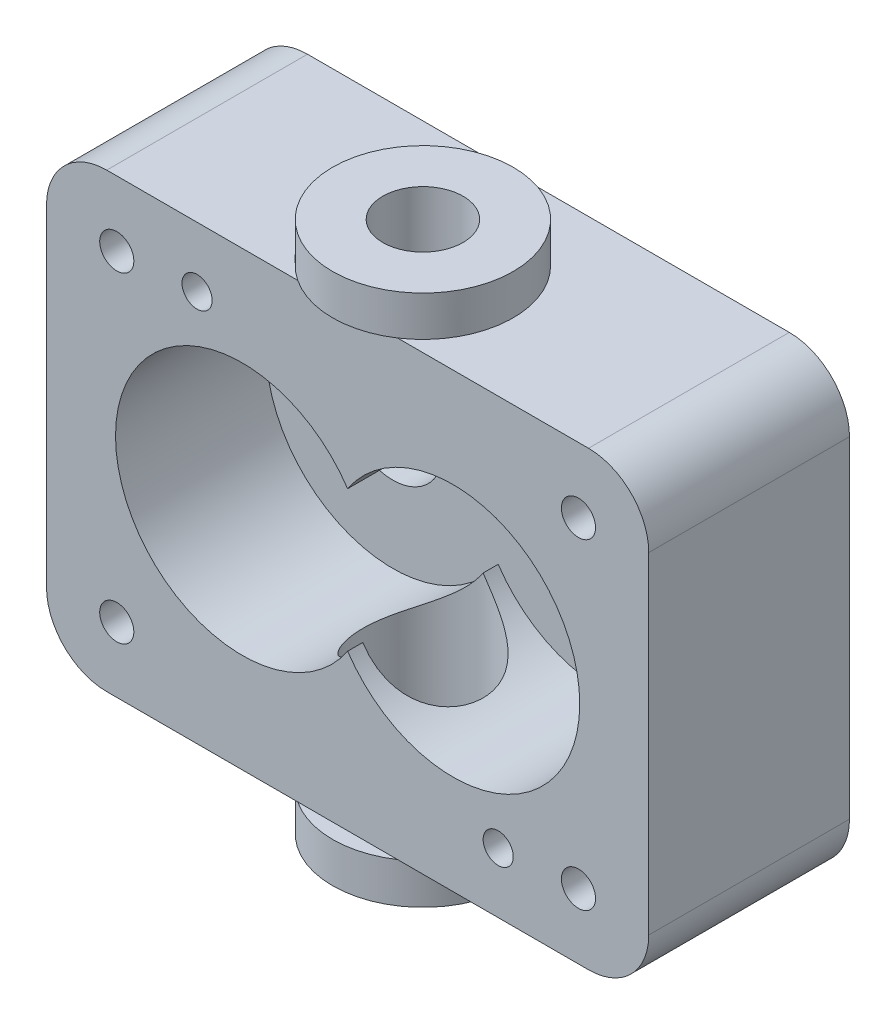
from build123d import *

# Parameters (mm, degrees)
EXTRUDE_1_DEPTH     = 40
SKETCH_2_R          = 18
EXTRUDE_2_DEPTH     = 8
EXTRUDE_START       = -8
SKETCH_3_R          = 18
EXTRUDE_3_DEPTH     = 8
SKETCH_4_R          = 25.25
CUT_EXTRUDE_1_DEPTH = 30
SKETCH_5_R          = 25.25
CUT_EXTRUDE_2_DEPTH = 30
SKETCH_6_R          = 10
CUT_EXTRUDE_3_DEPTH = 10
SKETCH_7_R          = 7.5
CUT_EXTRUDE_4_DEPTH = 8
SKETCH_8_R          = 12
CUT_EXTRUDE_5_DEPTH = 40
SKETCH_9_R          = 8
CUT_EXTRUDE_6_DEPTH = 40
SKETCH_10_R         = 3.4
CUT_EXTRUDE_7_DEPTH = 20
SKETCH_11_R         = 3
CUT_EXTRUDE_8_DEPTH = 12


with BuildPart() as part:
    # 草图1 → 凸台-拉伸1 (new body)
    with BuildSketch(Plane.XY):
        with BuildLine():
            Line((-48, -45), (48, -45))
            ThreePointArc((48, -45), (56.485281374, -41.485281374), (60, -33))
            Line((60, -33), (60, 33))
            ThreePointArc((60, 33), (56.485281374, 41.485281374), (48, 45))
            Line((48, 45), (-48, 45))
            ThreePointArc((-48, 45), (-56.485281374, 41.485281374), (-60, 33))
            Line((-60, 33), (-60, -33))
            ThreePointArc((-60, -33), (-56.485281374, -41.485281374), (-48, -45))
        make_face()
    extrude(amount=EXTRUDE_1_DEPTH)

    # 草图2 → 凸台-拉伸2 (add)
    with BuildSketch(Plane(origin=(0, 45, 0), x_dir=(1, 0, 0), z_dir=(0, 1, 0))):
        with Locations(Location((0, -25, 0), (0, 0, 236.442690238))):
            Circle(SKETCH_2_R)
    extrude(amount=EXTRUDE_2_DEPTH)

    # 草图3 → 凸台-拉伸3 (add)
    with BuildSketch(Plane(origin=(0, -45, 0), x_dir=(1, 0, 0), z_dir=(0, 1, 0)).offset(EXTRUDE_START)):
        with Locations(Location((0, -25, 0), (0, 0, 236.442690238))):
            Circle(SKETCH_3_R)
    extrude(amount=EXTRUDE_3_DEPTH)

    # 草图4 → 切除-拉伸1 (cut)
    with BuildSketch(Plane.XY.offset(40)):
        with Locations((-21, 0)):
            Circle(SKETCH_4_R)
    extrude(amount=-CUT_EXTRUDE_1_DEPTH, mode=Mode.SUBTRACT)

    # 草图5 → 切除-拉伸2 (cut)
    with BuildSketch(Plane.XY.offset(40)):
        with Locations((21, 0)):
            Circle(SKETCH_5_R)
    extrude(amount=-CUT_EXTRUDE_2_DEPTH, mode=Mode.SUBTRACT)

    # 草图6 → 切除-拉伸3 (cut)
    with BuildSketch(Plane.XY.offset(10)):
        with Locations((-21, 0)):
            Circle(SKETCH_6_R)
    extrude(amount=-CUT_EXTRUDE_3_DEPTH, mode=Mode.SUBTRACT)

    # 草图7 → 切除-拉伸4 (cut)
    with BuildSketch(Plane.XY.offset(10)):
        with Locations((21, 0)):
            Circle(SKETCH_7_R)
    extrude(amount=-CUT_EXTRUDE_4_DEPTH, mode=Mode.SUBTRACT)

    # 草图8 → 切除-拉伸5 (cut)
    with BuildSketch(Plane(origin=(0, -53, 0), x_dir=(1, 0, 0), z_dir=(0, 1, 0))):
        with Locations(Location((0, -25, 0), (0, 0, 270))):
            Circle(SKETCH_8_R)
    extrude(amount=CUT_EXTRUDE_5_DEPTH, mode=Mode.SUBTRACT)

    # 草图9 → 切除-拉伸6 (cut)
    with BuildSketch(Plane(origin=(0, 53, 0), x_dir=(1, 0, 0), z_dir=(0, 1, 0))):
        with Locations(Location((0, -25, 0), (0, 0, 270))):
            Circle(SKETCH_9_R)
    extrude(amount=-CUT_EXTRUDE_6_DEPTH, mode=Mode.SUBTRACT)

    # 草图10 → 切除-拉伸7 (cut)
    with BuildSketch(Plane.XY.offset(40)):
        with Locations((-46, 32)):
            Circle(SKETCH_10_R)
        with Locations((46, 32)):
            Circle(SKETCH_10_R)
        with Locations((-46, -32)):
            Circle(SKETCH_10_R)
        with Locations((46, -32)):
            Circle(SKETCH_10_R)
    extrude(amount=-CUT_EXTRUDE_7_DEPTH, mode=Mode.SUBTRACT)

    # 草图11 → 切除-拉伸8 (cut)
    with BuildSketch(Plane.XY.offset(40)):
        with Locations((-30, 33)):
            Circle(SKETCH_11_R)
        with Locations((30, -33)):
            Circle(SKETCH_11_R)
    extrude(amount=-CUT_EXTRUDE_8_DEPTH, mode=Mode.SUBTRACT)


solid = part.part
